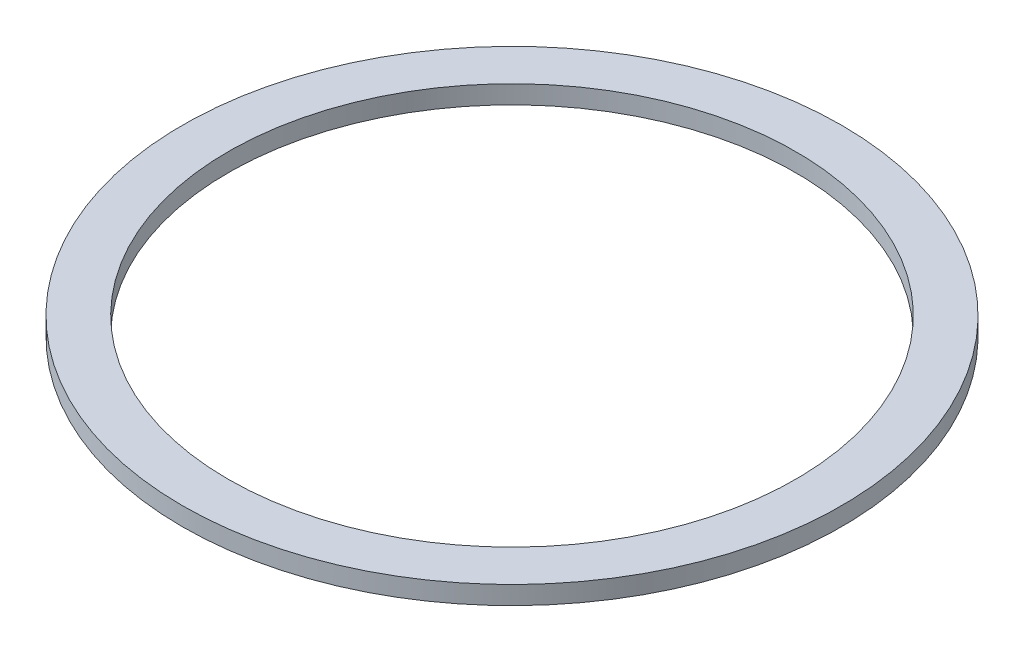
from build123d import *

# Parameters (mm, degrees)
ESQUISSE1_R        = 18
ESQUISSE1_R_2      = 15.5
BOSS_EXTRU_1_DEPTH = 1


with BuildPart() as part:
    # Esquisse1 → Boss.-Extru.1 (new body)
    with BuildSketch(Plane(origin=(0, 0, 0), x_dir=(1, 0, 0), z_dir=(0, 1, 0))):
        with Locations(Location((0, 0, 0), (0, 0, 270))):
            Circle(ESQUISSE1_R)
        with Locations(Location((0, 0, 0), (0, 0, 270))):
            Circle(ESQUISSE1_R_2, mode=Mode.SUBTRACT)
    extrude(amount=BOSS_EXTRU_1_DEPTH)


solid = part.part
